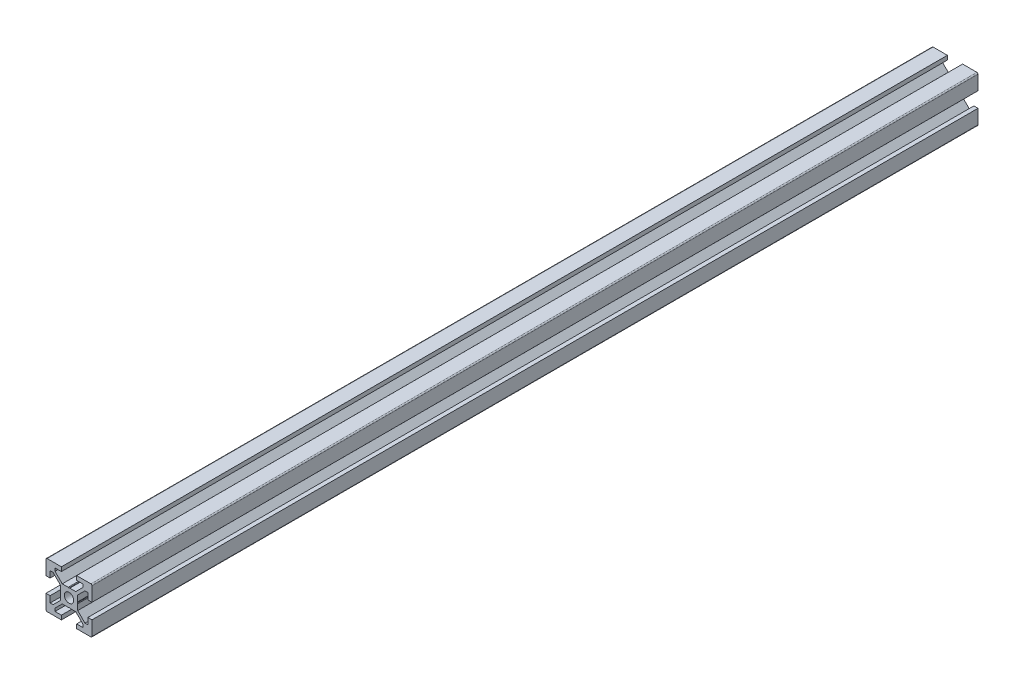
from build123d import *

# Parameters (mm, degrees)
SKETCH1_R           = 2.05
BOSS_EXTRUDE1_DEPTH = 385
FILLET1_R           = 0.5


with BuildPart() as part:
    # Sketch1 → Boss-Extrude1 (new body)
    with BuildSketch(Plane.XY):
        Polygon((-3.3, 10), (-3.3, 8.2), (-6.08, 8.2), (-6.08, 6.928528137), (-2.931471863, 3.78), (-0.34, 3.78), (0, 3.66), (0.34, 3.78), (2.931471863, 3.78), (6.08, 6.928528137), (6.08, 8.2), (3.3, 8.2), (3.3, 10), (10, 10), (10, 3.3), (8.2, 3.3), (8.2, 6.08), (6.928528137, 6.08), (3.78, 2.931471863), (3.78, 0.34), (3.66, 0), (3.78, -0.34), (3.78, -2.931471863), (6.928528137, -6.08), (8.2, -6.08), (8.2, -3.3), (10, -3.3), (10, -10), (3.3, -10), (3.3, -8.2), (6.08, -8.2), (6.08, -6.928528137), (2.931471863, -3.78), (0.34, -3.78), (0, -3.66), (-0.34, -3.78), (-2.931471863, -3.78), (-6.08, -6.928528137), (-6.08, -8.2), (-3.3, -8.2), (-3.3, -10), (-10, -10), (-10, -3.3), (-8.2, -3.3), (-8.2, -6.08), (-6.928528137, -6.08), (-3.78, -2.931471863), (-3.78, -0.34), (-3.66, 0), (-3.78, 0.34), (-3.78, 2.931471863), (-6.928528137, 6.08), (-8.2, 6.08), (-8.2, 3.3), (-10, 3.3), (-10, 10), align=None)
        Circle(SKETCH1_R, mode=Mode.SUBTRACT)
    extrude(amount=BOSS_EXTRUDE1_DEPTH)

    # Fillet1
    fillet1_edges = [part.edges().sort_by_distance(p)[0] for p in [
        (10, 10, 192.5),
        (10, -10, 192.5),
        (-10, -10, 192.5),
        (-10, 10, 192.5),
    ]]
    fillet(fillet1_edges, radius=FILLET1_R)


solid = part.part
